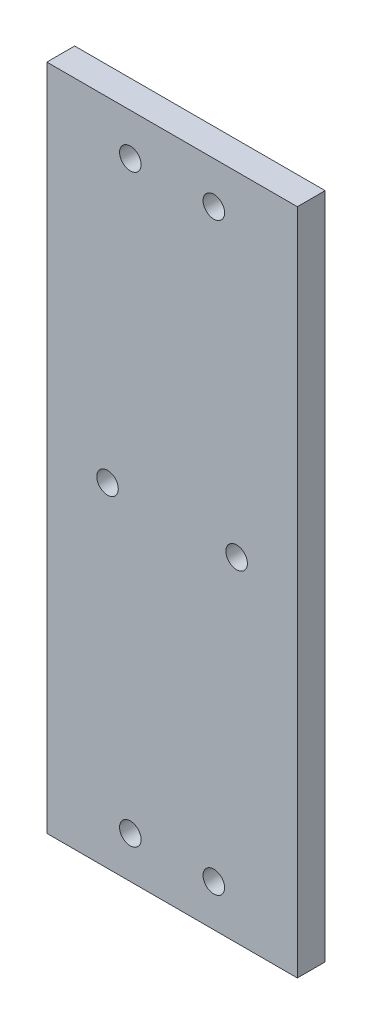
from build123d import *

# Parameters (mm, degrees)
SKETCH2_W                 = 57.15
SKETCH2_H                 = 152.4
BOSS_EXTRUDE1_DEPTH       = 6.35
F_8_CLEARANCE_HOLE1_D     = 4.9149
F_8_CLEARANCE_HOLE1_DEPTH = 9.191415072
F_8_CLEARANCE_HOLE1_TIP   = 1.476584928


with BuildPart() as part:
    # Sketch2 → Boss-Extrude1 (new body)
    with BuildSketch(Plane.XY):
        with Locations((28.575, 76.2)):
            Rectangle(SKETCH2_W, SKETCH2_H)
    extrude(amount=BOSS_EXTRUDE1_DEPTH)

    # #8 Clearance Hole1
    with Locations(Plane.XY.offset(6.35)):
        with Locations((19.05, 9.525), (38.1, 9.525), (19.05, 142.875), (38.1, 142.875), (13.843, 76.2), (43.307, 76.2)):
            Hole(F_8_CLEARANCE_HOLE1_D / 2, depth=F_8_CLEARANCE_HOLE1_DEPTH)
            with Locations((0, 0, -(F_8_CLEARANCE_HOLE1_DEPTH + F_8_CLEARANCE_HOLE1_TIP / 2))):  # 118° drill point
                Cone(0, F_8_CLEARANCE_HOLE1_D / 2, F_8_CLEARANCE_HOLE1_TIP, mode=Mode.SUBTRACT)


solid = part.part
